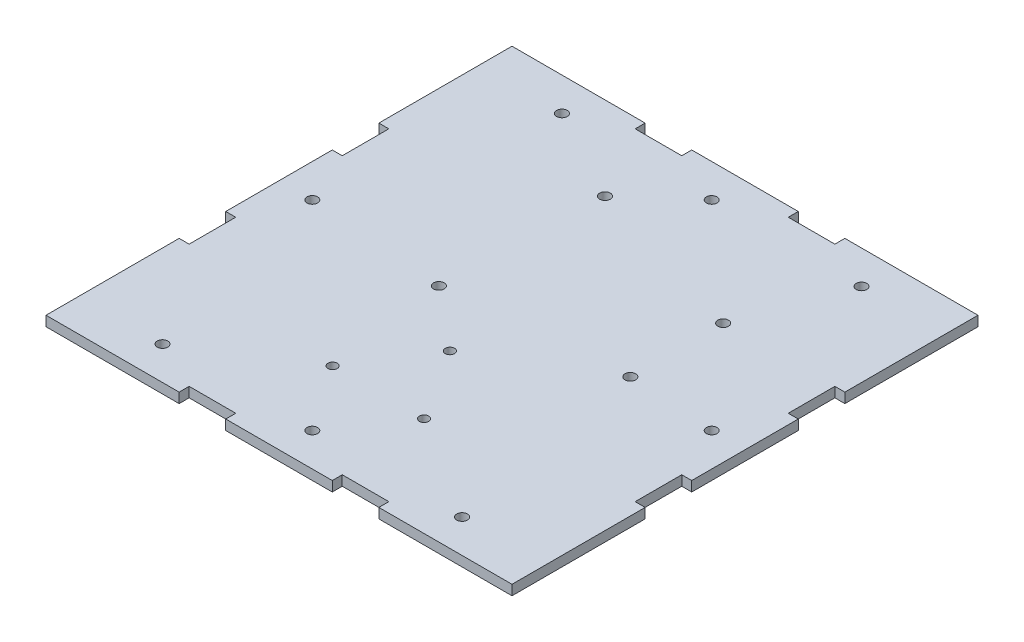
from build123d import *

# Parameters (mm, degrees)
SKETCH2_W           = 140
SKETCH2_H           = 140
SKETCH2_R           = 1.6
SKETCH2_R_2         = 1.4
BOSS_EXTRUDE2_DEPTH = 3
SKETCH3_W           = 14
SKETCH3_H           = 3
SKETCH3_W_2         = 3
SKETCH3_H_2         = 14
CUT_EXTRUDE1_DEPTH  = 10


with BuildPart() as part:
    # Sketch2 → Boss-Extrude2 (new body)
    with BuildSketch(Plane(origin=(0, 0, 0), x_dir=(1, 0, 0), z_dir=(0, 1, 0))):
        Rectangle(SKETCH2_W, SKETCH2_H)
        with Locations(Location((-17.011581703, 44.949159058, 0), (0, 0, 270))):
            Circle(SKETCH2_R, mode=Mode.SUBTRACT)
        with Locations(Location((-18.611581703, -3.350840942, 0), (0, 0, 270))):
            Circle(SKETCH2_R, mode=Mode.SUBTRACT)
        with Locations(Location((33.788418297, 29.649159058, 0), (0, 0, 270))):
            Circle(SKETCH2_R, mode=Mode.SUBTRACT)
        with Locations(Location((33.788418297, 1.749159058, 0), (0, 0, 270))):
            Circle(SKETCH2_R, mode=Mode.SUBTRACT)
        with Locations(Location((0, 60, 0), (0, 0, 270))):
            Circle(SKETCH2_R, mode=Mode.SUBTRACT)
        with Locations(Location((-60, 0, 0), (0, 0, 270))):
            Circle(SKETCH2_R, mode=Mode.SUBTRACT)
        with Locations(Location((0, -60, 0), (0, 0, 270))):
            Circle(SKETCH2_R, mode=Mode.SUBTRACT)
        with Locations(Location((60, 0, 0), (0, 0, 270))):
            Circle(SKETCH2_R, mode=Mode.SUBTRACT)
        with Locations(Location((-45, 60, 0), (0, 0, 270))):
            Circle(SKETCH2_R, mode=Mode.SUBTRACT)
        with Locations(Location((45, 60, 0), (0, 0, 270))):
            Circle(SKETCH2_R, mode=Mode.SUBTRACT)
        with Locations(Location((-45, -60, 0), (0, 0, 270))):
            Circle(SKETCH2_R, mode=Mode.SUBTRACT)
        with Locations(Location((45, -60, 0), (0, 0, 270))):
            Circle(SKETCH2_R, mode=Mode.SUBTRACT)
        with Locations(Location((-0.030225379, -18.62367845, 0), (0, 0, 270))):
            Circle(SKETCH2_R_2, mode=Mode.SUBTRACT)
        with Locations(Location((-13.780225379, -40.12367845, 0), (0, 0, 270))):
            Circle(SKETCH2_R_2, mode=Mode.SUBTRACT)
        with Locations(Location((13.719774621, -40.12367845, 0), (0, 0, 270))):
            Circle(SKETCH2_R_2, mode=Mode.SUBTRACT)
    extrude(amount=BOSS_EXTRUDE2_DEPTH)

    # Sketch3 → Cut-Extrude1 (cut)
    with BuildSketch(Plane(origin=(0, 3, 0), x_dir=(1, 0, 0), z_dir=(0, 1, 0))):
        with Locations((23, -68.5)):
            Rectangle(SKETCH3_W, SKETCH3_H)
        with Locations((23, 68.5)):
            Rectangle(SKETCH3_W, SKETCH3_H)
        with Locations((-23, 68.5)):
            Rectangle(SKETCH3_W, SKETCH3_H)
        with Locations((-23, -68.5)):
            Rectangle(SKETCH3_W, SKETCH3_H)
        with Locations((68.5, -23)):
            Rectangle(SKETCH3_W_2, SKETCH3_H_2)
        with Locations((68.5, 23)):
            Rectangle(SKETCH3_W_2, SKETCH3_H_2)
        with Locations((-68.5, 23)):
            Rectangle(SKETCH3_W_2, SKETCH3_H_2)
        with Locations((-68.5, -23)):
            Rectangle(SKETCH3_W_2, SKETCH3_H_2)
    extrude(amount=-CUT_EXTRUDE1_DEPTH, mode=Mode.SUBTRACT)


solid = part.part
